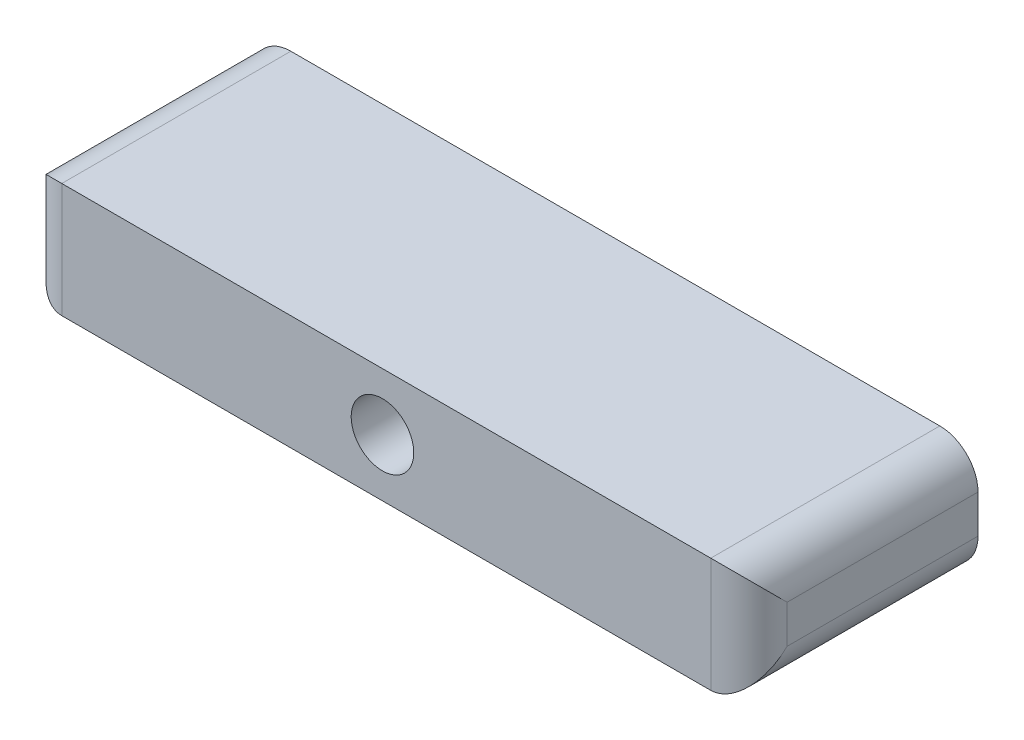
from build123d import *

# Parameters (mm, degrees)
ESQUISSE1_W             = 95
ESQUISSE1_H             = 30
BOSS_EXTRU_1_DEPTH      = 15
ESQUISSE2_R             = 4.25
ENL_V_MAT_EXTRU_2_DEPTH = 20
ENL_V_MAT_EXTRU_3_REACH = 102.747
ESQUISSE3_R             = 4.1
CONG_1_R                = 5


with BuildPart() as part:
    # Esquisse1 → Boss.-Extru.1 (new body)
    with BuildSketch(Plane(origin=(0, 0, 0), x_dir=(1, 0, 0), z_dir=(0, 1, 0))):
        with Locations((-47.5, -15)):
            Rectangle(ESQUISSE1_W, ESQUISSE1_H)
    extrude(amount=BOSS_EXTRU_1_DEPTH)

    # Esquisse2 → Enlèv. mat.-Extru.2 (cut)
    with BuildSketch(Plane(origin=(0, 0, 0), x_dir=(-1, 0, 0), z_dir=(0, 0, -1))):
        with Locations((10, 7)):
            Circle(ESQUISSE2_R)
        with Locations((85, 7)):
            Circle(ESQUISSE2_R)
    extrude(amount=-ENL_V_MAT_EXTRU_2_DEPTH, mode=Mode.SUBTRACT)

    # Esquisse3 → Enlèv. mat.-Extru.3 (cut, up to next)
    with BuildSketch(Plane(origin=(0, 0, 0), x_dir=(-1, 0, 0), z_dir=(0, 0, -1)), mode=Mode.PRIVATE) as enl_v_mat_extru_3_sk1:
        with Locations((48, 7.5)):
            Circle(ESQUISSE3_R)
    enl_v_mat_extru_3_tool1 = extrude(enl_v_mat_extru_3_sk1.sketch, amount=-ENL_V_MAT_EXTRU_3_REACH, mode=Mode.PRIVATE) & part.part
    add(enl_v_mat_extru_3_tool1.solids().sort_by_distance((-48, 7.5, 0))[0], mode=Mode.SUBTRACT)

    # Congé1
    cong_1_edges = [part.edges().sort_by_distance(p)[0] for p in [
        (-95, 15, 15),
        (0, 15, 15),
        (-95, 0, 15),
        (0, 0, 15),
        (0, 7.5, 30),
        (-95, 7.5, 30),
    ]]
    fillet(cong_1_edges, radius=CONG_1_R)


solid = part.part
